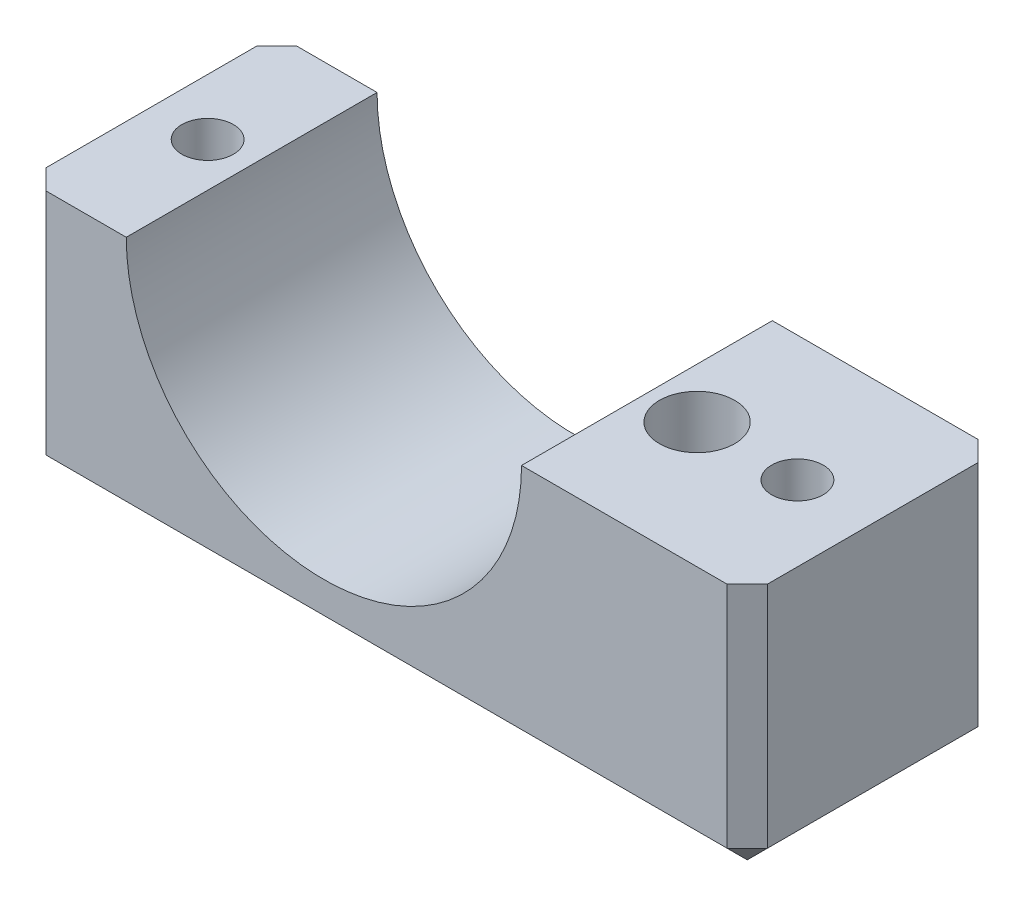
from build123d import *

# Parameters (mm, degrees)
BOSS_EXTRUDE1_DEPTH                 = 31.75
F_5_16_18_TAPPED_HOLE1_D            = 6.5278
F_3_8_0_375_CLEARANCE_DOWEL_HOLE2_D = 9.525
CHAMFER1_SIZE                       = 2.54


with BuildPart() as part:
    # Sketch1 → Boss-Extrude1 (new body)
    with BuildSketch(Plane.XY):
        with BuildLine():
            Line((0, 0), (12.7, 0))
            ThreePointArc((12.7, 0), (37.719, -25.019), (62.738, 0))
            Line((62.738, 0), (91.313, 0))
            Line((91.313, 0), (91.313, -31.496))
            Line((91.313, -31.496), (0, -31.496))
            Line((0, -31.496), (0, 0))
        make_face()
    extrude(amount=BOSS_EXTRUDE1_DEPTH)

    # 5/16-18 Tapped Hole1 (through all)
    with Locations(Plane(origin=(0, -31.496, 0), x_dir=(-1, 0, 0), z_dir=(0, -1, 0))):
        with Locations((-7.1247, -15.875), (-81.788, -15.875)):
            Hole(F_5_16_18_TAPPED_HOLE1_D / 2)

    # 3/8 (0.375) Clearance Dowel Hole2 (through all)
    with Locations(Plane(origin=(0, -31.496, 0), x_dir=(-1, 0, 0), z_dir=(0, -1, 0))):
        with Locations((-69.088, -15.875)):
            Hole(F_3_8_0_375_CLEARANCE_DOWEL_HOLE2_D / 2)

    # Chamfer1
    chamfer1_edges = [part.edges().sort_by_distance(p)[0] for p in [
        (91.313, -15.748, 31.75),
        (91.313, -31.496, 15.875),
        (0, -31.496, 15.875),
        (0, -15.748, 31.75),
        (45.6565, -31.496, 31.75),
        (91.313, -15.748, 0),
        (45.6565, -31.496, 0),
        (0, -15.748, 0),
    ]]
    chamfer(chamfer1_edges, length=CHAMFER1_SIZE)


solid = part.part
